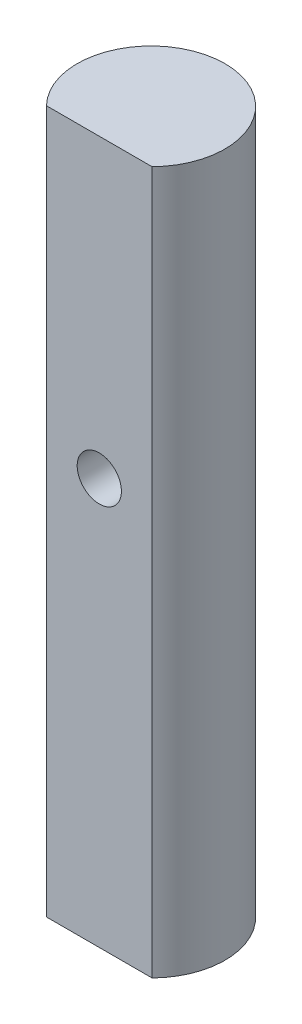
from build123d import *

# Parameters (mm, degrees)
SKETCH1_R              = 6.35
BOSS_EXTRUDE1_DEPTH    = 60.32492963
CUT_EXTRUDE1_DEPTH     = 61.989688759
F_10_24_TAPPED_HOLE1_D = 3.7973


with BuildPart() as part:
    # Sketch1 → Boss-Extrude1 (new body)
    with BuildSketch(Plane(origin=(0, 0, 0), x_dir=(1, 0, 0), z_dir=(0, 1, 0))):
        with Locations(Location((0, 0, 0), (0, 0, 90))):
            Circle(SKETCH1_R)
    extrude(amount=BOSS_EXTRUDE1_DEPTH)

    # Sketch2 → Cut-Extrude1 (cut, through all)
    with BuildSketch(Plane(origin=(0, 60.32492963, 0), x_dir=(1, 0, 0), z_dir=(0, 1, 0))):
        Polygon((0, -4.445), (-5.65519603, -4.445), (-5.65519603, -6.850474894), (5.907942222, -6.850474894), (5.907942222, -4.445), align=None)
    extrude(amount=-CUT_EXTRUDE1_DEPTH, mode=Mode.SUBTRACT)

    # #10-24 Tapped Hole1 (through all)
    with Locations(Plane.XY.offset(4.445)):
        with Locations((0, 34.878054704)):
            Hole(F_10_24_TAPPED_HOLE1_D / 2)


solid = part.part
